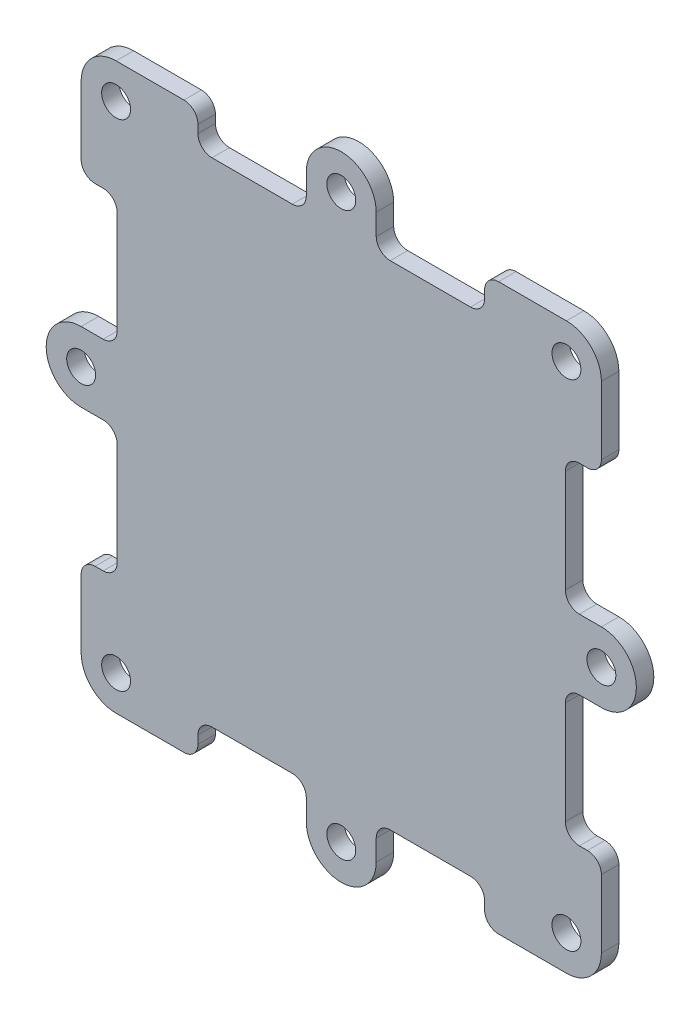
from build123d import *

# Parameters (mm, degrees)
SKETCH1_R           = 2.625
BOSS_EXTRUDE1_DEPTH = 3.175


with BuildPart() as part:
    # Sketch1 → Boss-Extrude1 (new body)
    with BuildSketch(Plane.XY):
        with BuildLine():
            Line((4.813695848, 148.856298887), (4.813695848, 136.524994751))
            ThreePointArc((4.813695848, 136.524994751), (5.557644624, 134.728943527), (7.353695848, 133.984994751))
            Line((7.353695848, 133.984994751), (8.813799985, 133.984994751))
            ThreePointArc((8.813799985, 133.984994751), (10.609851209, 133.241045975), (11.353799985, 131.444994751))
            Line((11.353799985, 131.444994751), (11.353799985, 112.775997772))
            ThreePointArc((11.353799985, 112.775997772), (10.609851209, 110.979946548), (8.813799985, 110.235997772))
            Line((8.813799985, 110.235997772), (4.813695848, 110.235997772))
            ThreePointArc((4.813695848, 110.235997772), (-1.536304152, 103.885997772), (4.813695848, 97.535997772))
            Line((4.813695848, 97.535997772), (8.813799985, 97.535997772))
            ThreePointArc((8.813799985, 97.535997772), (10.609851209, 96.792048996), (11.353799985, 94.995997772))
            Line((11.353799985, 94.995997772), (11.353799985, 76.327000793))
            ThreePointArc((11.353799985, 76.327000793), (10.609851209, 74.530949569), (8.813799985, 73.787000793))
            Line((8.813799985, 73.787000793), (7.353695848, 73.787000793))
            ThreePointArc((7.353695848, 73.787000793), (5.557644624, 73.043052018), (4.813695848, 71.247000793))
            Line((4.813695848, 71.247000793), (4.813695848, 58.915696657))
            ThreePointArc((4.813695848, 58.915696657), (6.673567788, 54.425568596), (11.163695848, 52.565696657))
            Line((11.163695848, 52.565696657), (23.494999985, 52.565696657))
            ThreePointArc((23.494999985, 52.565696657), (25.291051209, 53.309645433), (26.034999985, 55.105696657))
            Line((26.034999985, 55.105696657), (26.034999985, 56.565800793))
            ThreePointArc((26.034999985, 56.565800793), (26.778948761, 58.361852018), (28.574999985, 59.105800793))
            Line((28.574999985, 59.105800793), (43.179998741, 59.105800793))
            ThreePointArc((43.179998741, 59.105800793), (44.976049965, 58.361852018), (45.719998741, 56.565800793))
            Line((45.719998741, 56.565800793), (45.719998741, 52.755800793))
            ThreePointArc((45.719998741, 52.755800793), (52.069998741, 46.405800793), (58.419998741, 52.755800793))
            Line((58.419998741, 52.755800793), (58.419998741, 56.565800793))
            ThreePointArc((58.419998741, 56.565800793), (59.163947517, 58.361852018), (60.959998741, 59.105800793))
            Line((60.959998741, 59.105800793), (75.564997498, 59.105800793))
            ThreePointArc((75.564997498, 59.105800793), (77.361048722, 58.361852018), (78.104997498, 56.565800793))
            Line((78.104997498, 56.565800793), (78.104997498, 55.105696657))
            ThreePointArc((78.104997498, 55.105696657), (78.848946273, 53.309645433), (80.644997498, 52.565696657))
            Line((80.644997498, 52.565696657), (92.976301634, 52.565696657))
            ThreePointArc((92.976301634, 52.565696657), (97.466429695, 54.425568596), (99.326301634, 58.915696657))
            Line((99.326301634, 58.915696657), (99.326301634, 71.247000793))
            ThreePointArc((99.326301634, 71.247000793), (98.582352858, 73.043052018), (96.786301634, 73.787000793))
            Line((96.786301634, 73.787000793), (95.326197498, 73.787000793))
            ThreePointArc((95.326197498, 73.787000793), (93.530146273, 74.530949569), (92.786197498, 76.327000793))
            Line((92.786197498, 76.327000793), (92.786197498, 94.995997772))
            ThreePointArc((92.786197498, 94.995997772), (93.530146273, 96.792048996), (95.326197498, 97.535997772))
            Line((95.326197498, 97.535997772), (99.326301634, 97.535997772))
            ThreePointArc((99.326301634, 97.535997772), (105.676301634, 103.885997772), (99.326301634, 110.235997772))
            Line((99.326301634, 110.235997772), (95.326197498, 110.235997772))
            ThreePointArc((95.326197498, 110.235997772), (93.530146273, 110.979946548), (92.786197498, 112.775997772))
            Line((92.786197498, 112.775997772), (92.786197498, 131.444994751))
            ThreePointArc((92.786197498, 131.444994751), (93.530146273, 133.241045975), (95.326197498, 133.984994751))
            Line((95.326197498, 133.984994751), (96.786301634, 133.984994751))
            ThreePointArc((96.786301634, 133.984994751), (98.582352858, 134.728943527), (99.326301634, 136.524994751))
            Line((99.326301634, 136.524994751), (99.326301634, 148.856298887))
            ThreePointArc((99.326301634, 148.856298887), (97.466429695, 153.346426948), (92.976301634, 155.206298887))
            Line((92.976301634, 155.206298887), (80.644997498, 155.206298887))
            ThreePointArc((80.644997498, 155.206298887), (78.848946273, 154.462350112), (78.104997498, 152.666298887))
            Line((78.104997498, 152.666298887), (78.104997498, 151.206194751))
            ThreePointArc((78.104997498, 151.206194751), (77.361048722, 149.410143527), (75.564997498, 148.666194751))
            Line((75.564997498, 148.666194751), (60.959998741, 148.666194751))
            ThreePointArc((60.959998741, 148.666194751), (59.163947517, 149.410143527), (58.419998741, 151.206194751))
            Line((58.419998741, 151.206194751), (58.419998741, 155.016194751))
            ThreePointArc((58.419998741, 155.016194751), (52.069998741, 161.366194751), (45.719998741, 155.016194751))
            Line((45.719998741, 155.016194751), (45.719998741, 151.206194751))
            ThreePointArc((45.719998741, 151.206194751), (44.976049965, 149.410143527), (43.179998741, 148.666194751))
            Line((43.179998741, 148.666194751), (28.574999985, 148.666194751))
            ThreePointArc((28.574999985, 148.666194751), (26.778948761, 149.410143527), (26.034999985, 151.206194751))
            Line((26.034999985, 151.206194751), (26.034999985, 152.666298887))
            ThreePointArc((26.034999985, 152.666298887), (25.291051209, 154.462350112), (23.494999985, 155.206298887))
            Line((23.494999985, 155.206298887), (11.163695848, 155.206298887))
            ThreePointArc((11.163695848, 155.206298887), (6.673567788, 153.346426948), (4.813695848, 148.856298887))
        make_face()
        with Locations((11.163695848, 148.856298887)):
            Circle(SKETCH1_R, mode=Mode.SUBTRACT)
        with Locations((92.976301634, 148.856298887)):
            Circle(SKETCH1_R, mode=Mode.SUBTRACT)
        with Locations((52.069998741, 155.016194751)):
            Circle(SKETCH1_R, mode=Mode.SUBTRACT)
        with Locations((99.326301634, 103.885997772)):
            Circle(SKETCH1_R, mode=Mode.SUBTRACT)
        with Locations((92.976301634, 58.915696657)):
            Circle(SKETCH1_R, mode=Mode.SUBTRACT)
        with Locations((52.069998741, 52.755800793)):
            Circle(SKETCH1_R, mode=Mode.SUBTRACT)
        with Locations((11.163695848, 58.915696657)):
            Circle(SKETCH1_R, mode=Mode.SUBTRACT)
        with Locations((4.813695848, 103.885997772)):
            Circle(SKETCH1_R, mode=Mode.SUBTRACT)
    extrude(amount=BOSS_EXTRUDE1_DEPTH)


solid = part.part
